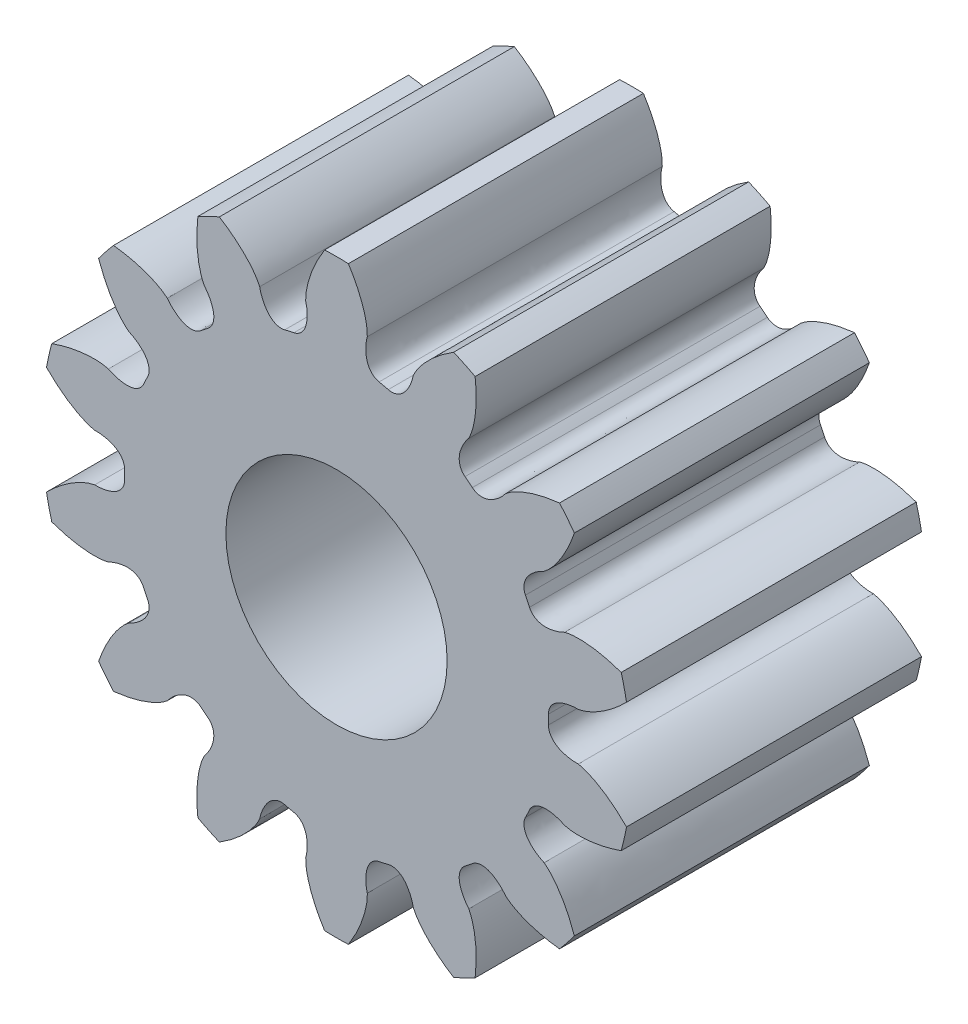
from build123d import *

# Parameters (mm, degrees)
EXTRUDE1_DEPTH = 4
SKETCH2_R      = 1.5
EXTRUDE2_DEPTH = 7.889429897


with BuildPart() as part:
    # Sketch1 → Extrude1 (new body)
    with BuildSketch(Plane.XY):
        with BuildLine():
            ThreePointArc((0.161451344, 3.996740355), (0, 4), (-0.161451344, 3.996740355))
            add(Edge.make_bspline(
                [(-0.41734284, 3.267106158), (-0.418050006, 3.293711217), (-0.417238008, 3.320180721), (-0.414906845, 3.34651467), (-0.412519014, 3.373488775), (-0.407997305, 3.400378217), (-0.402961586, 3.427010307), (-0.397809352, 3.454258609), (-0.391328249, 3.481322555), (-0.384194974, 3.508127789), (-0.376900876, 3.535537356), (-0.368546632, 3.562717007), (-0.359559396, 3.589622711), (-0.35037421, 3.61712103), (-0.340275181, 3.6443583), (-0.32957411, 3.671305216), (-0.318642529, 3.698832595), (-0.306892071, 3.726074032), (-0.294569215, 3.753008941), (-0.281986575, 3.780511674), (-0.26865316, 3.807706899), (-0.254773956, 3.834579837), (-0.240608244, 3.862007514), (-0.225743937, 3.889108115), (-0.210357616, 3.915871073), (-0.194660131, 3.943175271), (-0.178358041, 3.970131699), (-0.161451344, 3.996740355)],
                knots=[0, 0, 0, 0, 1, 1, 1, 2, 2, 2, 3, 3, 3, 4, 4, 4, 5, 5, 5, 6, 6, 6, 7, 7, 7, 8, 8, 8, 9, 9, 9, 9], degree=3))
            add(Edge.make_bspline(
                [(-0.41734284, 3.267106158), (-0.402119361, 3.209381071), (-0.395699009, 3.151699222), (-0.398081786, 3.094060611), (-0.399327936, 3.063916621), (-0.401904813, 3.033023286), (-0.409043489, 3.003664119), (-0.413736949, 2.984361367), (-0.419593991, 2.964934925), (-0.427642919, 2.946758283), (-0.433750196, 2.932966409), (-0.440827339, 2.919331468), (-0.449158532, 2.906750547), (-0.456096327, 2.896273794), (-0.46384579, 2.886114295), (-0.472383788, 2.876890981), (-0.479948802, 2.868718749), (-0.488195574, 2.86097345), (-0.496954152, 2.85409329), (-0.505054754, 2.847729993), (-0.513724525, 2.841879116), (-0.522714724, 2.836848669), (-0.531294393, 2.832047933), (-0.540339799, 2.827832828), (-0.549555771, 2.824407573), (-0.558572093, 2.821056522), (-0.567845845, 2.818396315), (-0.577377026, 2.816426951)],
                knots=[0, 0, 0, 0, 1, 1, 1, 2, 2, 2, 3, 3, 3, 4, 4, 4, 5, 5, 5, 6, 6, 6, 7, 7, 7, 8, 8, 8, 9, 9, 9, 9], degree=3))
            ThreePointArc((-0.577377026, 2.816426951), (-0.639747685, 2.802917748), (-0.701803131, 2.788027505))
            add(Edge.make_bspline(
                [(-1.04153133, 3.124639209), (-1.030201234, 3.066025482), (-1.010958555, 3.011270246), (-0.983803291, 2.9603735), (-0.969601561, 2.933755388), (-0.95387576, 2.907039519), (-0.93470557, 2.883685179), (-0.922101758, 2.868330416), (-0.908395929, 2.853369072), (-0.893257545, 2.840484782), (-0.881771009, 2.830708583), (-0.869478745, 2.821494582), (-0.856513942, 2.813774333), (-0.845717511, 2.807345301), (-0.834327445, 2.801554275), (-0.822633129, 2.796948855), (-0.812271488, 2.792868265), (-0.801480845, 2.789468131), (-0.790604448, 2.787069526), (-0.780545128, 2.784851113), (-0.770195334, 2.783341328), (-0.759912814, 2.782709753), (-0.750099839, 2.782107018), (-0.740121344, 2.782233994), (-0.730331878, 2.783146607), (-0.720754486, 2.784039449), (-0.711244904, 2.785666415), (-0.701803131, 2.788027505)],
                knots=[0, 0, 0, 0, 1, 1, 1, 2, 2, 2, 3, 3, 3, 4, 4, 4, 5, 5, 5, 6, 6, 6, 7, 7, 7, 8, 8, 8, 9, 9, 9, 9], degree=3))
            add(Edge.make_bspline(
                [(-1.04153133, 3.124639209), (-1.052437698, 3.148916366), (-1.06465397, 3.172412253), (-1.078180148, 3.195126867), (-1.092035135, 3.218393654), (-1.107775945, 3.240658309), (-1.123868202, 3.262468076), (-1.1403328, 3.284782477), (-1.157914678, 3.306354205), (-1.175971892, 3.327409874), (-1.194436212, 3.348940251), (-1.213755935, 3.369803499), (-1.233527102, 3.390145285), (-1.253733742, 3.410935112), (-1.274650461, 3.431093239), (-1.295983622, 3.450728552), (-1.317776318, 3.470786827), (-1.340182731, 3.490232182), (-1.36297186, 3.509153009), (-1.386241415, 3.528472713), (-1.410053973, 3.547189611), (-1.434218435, 3.565379332), (-1.458881724, 3.583944542), (-1.484032512, 3.601911959), (-1.50950712, 3.619348677), (-1.535496912, 3.637138026), (-1.561880544, 3.654351716), (-1.588658015, 3.670989746)],
                knots=[0, 0, 0, 0, 1, 1, 1, 2, 2, 2, 3, 3, 3, 4, 4, 4, 5, 5, 5, 6, 6, 6, 7, 7, 7, 8, 8, 8, 9, 9, 9, 9], degree=3))
            ThreePointArc((-1.588658015, 3.670989746), (-1.735534956, 3.603875472), (-1.879583284, 3.53088752))
            add(Edge.make_bspline(
                [(-1.793557142, 2.762482665), (-1.805737779, 2.786146167), (-1.816490882, 2.810346679), (-1.825816449, 2.835084201), (-1.835368712, 2.86042307), (-1.842961685, 2.886611516), (-1.84997989, 2.912791117), (-1.857160482, 2.939576459), (-1.863063817, 2.966772277), (-1.868267313, 2.994017971), (-1.873588124, 3.021877928), (-1.877854018, 3.049990718), (-1.881430745, 3.078131335), (-1.885086253, 3.106891767), (-1.88780515, 3.135813504), (-1.889855648, 3.164734857), (-1.891950315, 3.194279203), (-1.893183135, 3.223921223), (-1.893767244, 3.253535424), (-1.894363666, 3.283773933), (-1.89415024, 3.314061136), (-1.89330524, 3.344294778), (-1.892442797, 3.375152533), (-1.89080903, 3.406018712), (-1.888558447, 3.436807178), (-1.886262349, 3.468218295), (-1.883270628, 3.499578408), (-1.879583284, 3.53088752)],
                knots=[0, 0, 0, 0, 1, 1, 1, 2, 2, 2, 3, 3, 3, 4, 4, 4, 5, 5, 5, 6, 6, 6, 7, 7, 7, 8, 8, 8, 9, 9, 9, 9], degree=3))
            add(Edge.make_bspline(
                [(-1.793557142, 2.762482665), (-1.754795285, 2.717079378), (-1.723983532, 2.667895514), (-1.701121883, 2.614931073), (-1.689165639, 2.587231591), (-1.678083209, 2.558279593), (-1.671776468, 2.528730543), (-1.66762998, 2.509302947), (-1.664478174, 2.489259053), (-1.663843458, 2.469390165), (-1.663361856, 2.454314269), (-1.663822162, 2.438958954), (-1.66586965, 2.424009166), (-1.667574695, 2.411559741), (-1.670148678, 2.399043983), (-1.673839303, 2.387029566), (-1.677109346, 2.376384303), (-1.681178871, 2.365827889), (-1.686084888, 2.355828874), (-1.690622347, 2.346581023), (-1.695894941, 2.337547892), (-1.701812201, 2.329114914), (-1.707459254, 2.321067022), (-1.713780018, 2.313344689), (-1.720597159, 2.306259981), (-1.727266618, 2.299328753), (-1.734467759, 2.292908259), (-1.742200582, 2.286998498)],
                knots=[0, 0, 0, 0, 1, 1, 1, 2, 2, 2, 3, 3, 3, 4, 4, 4, 5, 5, 5, 6, 6, 6, 7, 7, 7, 8, 8, 8, 9, 9, 9, 9], degree=3))
            ThreePointArc((-1.742200582, 2.286998498), (-1.79253318, 2.247765512), (-1.84198257, 2.207425018))
            add(Edge.make_bspline(
                [(-2.294117446, 2.363299143), (-2.25847784, 2.315405944), (-2.217383378, 2.274422267), (-2.170834061, 2.24034811), (-2.146489578, 2.222527919), (-2.12072954, 2.205280923), (-2.093324727, 2.192557024), (-2.075306903, 2.18419145), (-2.056466894, 2.17665848), (-2.037237398, 2.171618435), (-2.022646652, 2.167794204), (-2.0075739, 2.164826091), (-1.992543325, 2.163495604), (-1.980026625, 2.162387642), (-1.967251898, 2.162112072), (-1.954717466, 2.163036705), (-1.943611449, 2.163855968), (-1.932414152, 2.165474439), (-1.921574142, 2.168032461), (-1.911548474, 2.170398316), (-1.90156856, 2.173528654), (-1.8920303, 2.177421042), (-1.882927598, 2.181135687), (-1.873992378, 2.185579595), (-1.865568342, 2.190649321), (-1.857326799, 2.195609219), (-1.849464876, 2.201201118), (-1.84198257, 2.207425018)],
                knots=[0, 0, 0, 0, 1, 1, 1, 2, 2, 2, 3, 3, 3, 4, 4, 4, 5, 5, 5, 6, 6, 6, 7, 7, 7, 8, 8, 8, 9, 9, 9, 9], degree=3))
            add(Edge.make_bspline(
                [(-2.294117446, 2.363299143), (-2.314477208, 2.38044001), (-2.335678172, 2.39630863), (-2.357720339, 2.410905003), (-2.380298332, 2.4258562), (-2.404140584, 2.439086278), (-2.428102109, 2.451754032), (-2.452618055, 2.464714891), (-2.477818401, 2.476521855), (-2.503223102, 2.487657626), (-2.52920056, 2.499044456), (-2.555659253, 2.50945908), (-2.582298429, 2.519208008), (-2.60952435, 2.529171662), (-2.637115947, 2.538258083), (-2.664855903, 2.546692777), (-2.693193403, 2.555309163), (-2.721817908, 2.563107043), (-2.750559643, 2.570266287), (-2.779907293, 2.577576457), (-2.809482624, 2.584107918), (-2.839146276, 2.590011723), (-2.869422274, 2.596037399), (-2.899878121, 2.601312965), (-2.930395458, 2.605969887), (-2.961529961, 2.610720988), (-2.992769532, 2.614782558), (-3.02411417, 2.618154596)],
                knots=[0, 0, 0, 0, 1, 1, 1, 2, 2, 2, 3, 3, 3, 4, 4, 4, 5, 5, 5, 6, 6, 6, 7, 7, 7, 8, 8, 8, 9, 9, 9, 9], degree=3))
            ThreePointArc((-3.02411417, 2.618154596), (-3.12732593, 2.493959207), (-3.225440703, 2.365699108))
            add(Edge.make_bspline(
                [(-2.814535456, 1.7107156), (-2.835777039, 1.726750698), (-2.855965458, 1.74388901), (-2.875100712, 1.762130535), (-2.894701128, 1.780815496), (-2.912904901, 1.801116003), (-2.930586988, 1.821657923), (-2.948678203, 1.84267514), (-2.965796746, 1.864616365), (-2.982306398, 1.886906174), (-2.999188265, 1.909698515), (-3.015229386, 1.933176361), (-3.030661662, 1.956978297), (-3.046433844, 1.981304486), (-3.061432157, 2.006182385), (-3.075828097, 2.031349947), (-3.090534138, 2.057059641), (-3.104506061, 2.083231277), (-3.117881445, 2.109659315), (-3.1315388, 2.136644492), (-3.144487635, 2.164024921), (-3.156844202, 2.191631123), (-3.169455846, 2.2198072), (-3.181376205, 2.248325531), (-3.192707115, 2.277041472), (-3.204267175, 2.30633815), (-3.215178371, 2.335890695), (-3.225440703, 2.365699108)],
                knots=[0, 0, 0, 0, 1, 1, 1, 2, 2, 2, 3, 3, 3, 4, 4, 4, 5, 5, 5, 6, 6, 6, 7, 7, 7, 8, 8, 8, 9, 9, 9, 9], degree=3))
            add(Edge.make_bspline(
                [(-2.814535456, 1.7107156), (-2.759912481, 1.686626792), (-2.710811972, 1.65568238), (-2.667233928, 1.617882365), (-2.64444337, 1.598113615), (-2.621896644, 1.576837252), (-2.603393615, 1.552950869), (-2.59122844, 1.537246305), (-2.579692042, 1.520554897), (-2.570499395, 1.502929041), (-2.5635243, 1.489555086), (-2.5572766, 1.475520707), (-2.552634854, 1.461163041), (-2.548769443, 1.449206706), (-2.545658138, 1.436813588), (-2.543770415, 1.42438767), (-2.542097816, 1.413377801), (-2.541184075, 1.4021011), (-2.541265834, 1.390963658), (-2.54134145, 1.380662902), (-2.542172565, 1.37023664), (-2.5438449, 1.360071387), (-2.54544087, 1.350370321), (-2.547785086, 1.340670264), (-2.550853179, 1.331329315), (-2.553854806, 1.322190725), (-2.557557062, 1.313281601), (-2.561959946, 1.304601945)],
                knots=[0, 0, 0, 0, 1, 1, 1, 2, 2, 2, 3, 3, 3, 4, 4, 4, 5, 5, 5, 6, 6, 6, 7, 7, 7, 8, 8, 8, 9, 9, 9, 9], degree=3))
            ThreePointArc((-2.561959946, 1.304601945), (-2.590285495, 1.24741575), (-2.617334772, 1.189614934))
            add(Edge.make_bspline(
                [(-3.092325467, 1.133878697), (-3.039435211, 1.106191862), (-2.984628229, 1.087097063), (-2.927904521, 1.076594301), (-2.898239009, 1.071101539), (-2.867546825, 1.066739395), (-2.837335249, 1.06716606), (-2.817472064, 1.067446579), (-2.797229369, 1.068833982), (-2.777717398, 1.072636423), (-2.762912319, 1.075521598), (-2.748044422, 1.079387242), (-2.733925066, 1.084710037), (-2.722167182, 1.08914259), (-2.710537985, 1.094437056), (-2.699646036, 1.100708608), (-2.689995325, 1.106265459), (-2.680609137, 1.112581976), (-2.67195251, 1.119589979), (-2.663946201, 1.126071514), (-2.656312812, 1.133221973), (-2.649407981, 1.14086739), (-2.642818454, 1.148163684), (-2.636696238, 1.156044354), (-2.631306115, 1.164267071), (-2.626032762, 1.172311656), (-2.621375647, 1.180760944), (-2.617334772, 1.189614934)],
                knots=[0, 0, 0, 0, 1, 1, 1, 2, 2, 2, 3, 3, 3, 4, 4, 4, 5, 5, 5, 6, 6, 6, 7, 7, 7, 8, 8, 8, 9, 9, 9, 9], degree=3))
            add(Edge.make_bspline(
                [(-3.092325467, 1.133878697), (-3.118106122, 1.140488316), (-3.144092667, 1.145586695), (-3.170285102, 1.149173834), (-3.197114252, 1.152848173), (-3.224335694, 1.154423297), (-3.251420615, 1.155440032), (-3.279132225, 1.156480292), (-3.306959803, 1.156183979), (-3.334680277, 1.155194276), (-3.363025718, 1.154182259), (-3.391382913, 1.152085514), (-3.419613882, 1.149310689), (-3.448466657, 1.146474747), (-3.477268277, 1.142689784), (-3.505920791, 1.138253265), (-3.535190506, 1.133721179), (-3.564363667, 1.12832712), (-3.593365354, 1.122306804), (-3.622978437, 1.116159572), (-3.652458785, 1.10921196), (-3.681746376, 1.101660528), (-3.711638551, 1.093953211), (-3.741367303, 1.085492035), (-3.770883036, 1.0764468), (-3.800995681, 1.06721864), (-3.83090381, 1.057323646), (-3.860607426, 1.046761818)],
                knots=[0, 0, 0, 0, 1, 1, 1, 2, 2, 2, 3, 3, 3, 4, 4, 4, 5, 5, 5, 6, 6, 6, 7, 7, 7, 8, 8, 8, 9, 9, 9, 9], degree=3))
            ThreePointArc((-3.860607426, 1.046761818), (-3.899711649, 0.890083736), (-3.932460034, 0.731954975))
            add(Edge.make_bspline(
                [(-3.278060504, 0.32012033), (-3.304155878, 0.325351076), (-3.32978105, 0.332032735), (-3.354936019, 0.340165306), (-3.380702484, 0.348495572), (-3.405911577, 0.358887376), (-3.430755392, 0.369723036), (-3.456174042, 0.380809411), (-3.481117257, 0.393150313), (-3.505663126, 0.406069469), (-3.530762388, 0.41927989), (-3.555401594, 0.433472718), (-3.579632867, 0.448221707), (-3.60439785, 0.463295553), (-3.628704979, 0.479202241), (-3.652595069, 0.495631266), (-3.676999772, 0.512414188), (-3.700943487, 0.529931827), (-3.724460988, 0.547939305), (-3.748474269, 0.566326406), (-3.772020689, 0.585377031), (-3.795131454, 0.604888046), (-3.818719293, 0.624801826), (-3.841832806, 0.645323905), (-3.864500983, 0.666279777), (-3.887627589, 0.687659449), (-3.910280606, 0.709551181), (-3.932460034, 0.731954975)],
                knots=[0, 0, 0, 0, 1, 1, 1, 2, 2, 2, 3, 3, 3, 4, 4, 4, 5, 5, 5, 6, 6, 6, 7, 7, 7, 8, 8, 8, 9, 9, 9, 9], degree=3))
            add(Edge.make_bspline(
                [(-3.278060504, 0.32012033), (-3.218395163, 0.322117084), (-3.160730856, 0.315541045), (-3.105067583, 0.300392213), (-3.07595666, 0.292469637), (-3.046411294, 0.283082954), (-3.019376728, 0.26959023), (-3.001602329, 0.260719178), (-2.983966263, 0.250686195), (-2.968036402, 0.238794387), (-2.955949317, 0.229771251), (-2.944231044, 0.219837488), (-2.933819418, 0.208915656), (-2.925149144, 0.199820509), (-2.916968782, 0.19000464), (-2.9098766, 0.179628328), (-2.903592636, 0.170434492), (-2.897876608, 0.160670993), (-2.893117914, 0.15060103), (-2.888716712, 0.141287561), (-2.884941735, 0.131533217), (-2.882037918, 0.12164904), (-2.879266703, 0.112216218), (-2.877170071, 0.10245965), (-2.875881442, 0.092712551), (-2.874620729, 0.083176608), (-2.874090822, 0.073543416), (-2.874291722, 0.063812977)],
                knots=[0, 0, 0, 0, 1, 1, 1, 2, 2, 2, 3, 3, 3, 4, 4, 4, 5, 5, 5, 6, 6, 6, 7, 7, 7, 8, 8, 8, 9, 9, 9, 9], degree=3))
            ThreePointArc((-2.874291722, 0.063812977), (-2.875, 0), (-2.874291722, -0.063812977))
            add(Edge.make_bspline(
                [(-3.278060504, -0.32012033), (-3.218395163, -0.322117084), (-3.160730856, -0.315541045), (-3.105067583, -0.300392213), (-3.07595666, -0.292469637), (-3.046411294, -0.283082954), (-3.019376728, -0.26959023), (-3.001602329, -0.260719178), (-2.983966263, -0.250686195), (-2.968036402, -0.238794387), (-2.955949317, -0.229771251), (-2.944231044, -0.219837488), (-2.933819418, -0.208915656), (-2.925149144, -0.199820509), (-2.916968782, -0.19000464), (-2.9098766, -0.179628328), (-2.903592636, -0.170434492), (-2.897876608, -0.160670993), (-2.893117914, -0.15060103), (-2.888716712, -0.141287561), (-2.884941735, -0.131533217), (-2.882037918, -0.12164904), (-2.879266703, -0.112216218), (-2.877170071, -0.10245965), (-2.875881442, -0.092712551), (-2.874620729, -0.083176608), (-2.874090822, -0.073543416), (-2.874291722, -0.063812977)],
                knots=[0, 0, 0, 0, 1, 1, 1, 2, 2, 2, 3, 3, 3, 4, 4, 4, 5, 5, 5, 6, 6, 6, 7, 7, 7, 8, 8, 8, 9, 9, 9, 9], degree=3))
            add(Edge.make_bspline(
                [(-3.278060504, -0.32012033), (-3.304155878, -0.325351076), (-3.32978105, -0.332032735), (-3.354936019, -0.340165306), (-3.380702484, -0.348495572), (-3.405911577, -0.358887376), (-3.430755392, -0.369723036), (-3.456174042, -0.380809411), (-3.481117257, -0.393150313), (-3.505663126, -0.406069469), (-3.530762388, -0.41927989), (-3.555401594, -0.433472718), (-3.579632867, -0.448221707), (-3.60439785, -0.463295553), (-3.628704979, -0.479202241), (-3.652595069, -0.495631266), (-3.676999772, -0.512414188), (-3.700943487, -0.529931827), (-3.724460988, -0.547939305), (-3.748474269, -0.566326406), (-3.772020689, -0.585377031), (-3.795131454, -0.604888046), (-3.818719293, -0.624801826), (-3.841832806, -0.645323905), (-3.864500983, -0.666279777), (-3.887627589, -0.687659449), (-3.910280606, -0.709551181), (-3.932460034, -0.731954975)],
                knots=[0, 0, 0, 0, 1, 1, 1, 2, 2, 2, 3, 3, 3, 4, 4, 4, 5, 5, 5, 6, 6, 6, 7, 7, 7, 8, 8, 8, 9, 9, 9, 9], degree=3))
            ThreePointArc((-3.932460034, -0.731954975), (-3.899711649, -0.890083736), (-3.860607426, -1.046761818))
            add(Edge.make_bspline(
                [(-3.092325467, -1.133878697), (-3.118106122, -1.140488316), (-3.144092667, -1.145586695), (-3.170285102, -1.149173834), (-3.197114252, -1.152848173), (-3.224335694, -1.154423297), (-3.251420615, -1.155440032), (-3.279132225, -1.156480292), (-3.306959803, -1.156183979), (-3.334680277, -1.155194276), (-3.363025718, -1.154182259), (-3.391382913, -1.152085514), (-3.419613882, -1.149310689), (-3.448466657, -1.146474747), (-3.477268277, -1.142689784), (-3.505920791, -1.138253265), (-3.535190506, -1.133721179), (-3.564363667, -1.12832712), (-3.593365354, -1.122306804), (-3.622978437, -1.116159572), (-3.652458785, -1.10921196), (-3.681746376, -1.101660528), (-3.711638551, -1.093953211), (-3.741367303, -1.085492035), (-3.770883036, -1.0764468), (-3.800995681, -1.06721864), (-3.83090381, -1.057323646), (-3.860607426, -1.046761818)],
                knots=[0, 0, 0, 0, 1, 1, 1, 2, 2, 2, 3, 3, 3, 4, 4, 4, 5, 5, 5, 6, 6, 6, 7, 7, 7, 8, 8, 8, 9, 9, 9, 9], degree=3))
            add(Edge.make_bspline(
                [(-3.092325467, -1.133878697), (-3.039435211, -1.106191862), (-2.984628229, -1.087097063), (-2.927904521, -1.076594301), (-2.898239009, -1.071101539), (-2.867546825, -1.066739395), (-2.837335249, -1.06716606), (-2.817472064, -1.067446579), (-2.797229369, -1.068833982), (-2.777717398, -1.072636423), (-2.762912319, -1.075521598), (-2.748044422, -1.079387242), (-2.733925066, -1.084710037), (-2.722167182, -1.08914259), (-2.710537985, -1.094437056), (-2.699646036, -1.100708608), (-2.689995325, -1.106265459), (-2.680609137, -1.112581976), (-2.67195251, -1.119589979), (-2.663946201, -1.126071514), (-2.656312812, -1.133221973), (-2.649407981, -1.14086739), (-2.642818454, -1.148163684), (-2.636696238, -1.156044354), (-2.631306115, -1.164267071), (-2.626032762, -1.172311656), (-2.621375647, -1.180760944), (-2.617334772, -1.189614934)],
                knots=[0, 0, 0, 0, 1, 1, 1, 2, 2, 2, 3, 3, 3, 4, 4, 4, 5, 5, 5, 6, 6, 6, 7, 7, 7, 8, 8, 8, 9, 9, 9, 9], degree=3))
            ThreePointArc((-2.617334772, -1.189614934), (-2.590285495, -1.24741575), (-2.561959946, -1.304601945))
            add(Edge.make_bspline(
                [(-2.814535456, -1.7107156), (-2.759912481, -1.686626792), (-2.710811972, -1.65568238), (-2.667233928, -1.617882365), (-2.64444337, -1.598113615), (-2.621896644, -1.576837252), (-2.603393615, -1.552950869), (-2.59122844, -1.537246305), (-2.579692042, -1.520554897), (-2.570499395, -1.502929041), (-2.5635243, -1.489555086), (-2.5572766, -1.475520707), (-2.552634854, -1.461163041), (-2.548769443, -1.449206706), (-2.545658138, -1.436813588), (-2.543770415, -1.42438767), (-2.542097816, -1.413377801), (-2.541184075, -1.4021011), (-2.541265834, -1.390963658), (-2.54134145, -1.380662902), (-2.542172565, -1.37023664), (-2.5438449, -1.360071387), (-2.54544087, -1.350370321), (-2.547785086, -1.340670264), (-2.550853179, -1.331329315), (-2.553854806, -1.322190725), (-2.557557062, -1.313281601), (-2.561959946, -1.304601945)],
                knots=[0, 0, 0, 0, 1, 1, 1, 2, 2, 2, 3, 3, 3, 4, 4, 4, 5, 5, 5, 6, 6, 6, 7, 7, 7, 8, 8, 8, 9, 9, 9, 9], degree=3))
            add(Edge.make_bspline(
                [(-2.814535456, -1.7107156), (-2.835777039, -1.726750698), (-2.855965458, -1.74388901), (-2.875100712, -1.762130535), (-2.894701128, -1.780815496), (-2.912904901, -1.801116003), (-2.930586988, -1.821657923), (-2.948678203, -1.84267514), (-2.965796746, -1.864616365), (-2.982306398, -1.886906174), (-2.999188265, -1.909698515), (-3.015229386, -1.933176361), (-3.030661662, -1.956978297), (-3.046433844, -1.981304486), (-3.061432157, -2.006182385), (-3.075828097, -2.031349947), (-3.090534138, -2.057059641), (-3.104506061, -2.083231277), (-3.117881445, -2.109659315), (-3.1315388, -2.136644492), (-3.144487635, -2.164024921), (-3.156844202, -2.191631123), (-3.169455846, -2.2198072), (-3.181376205, -2.248325531), (-3.192707115, -2.277041472), (-3.204267175, -2.30633815), (-3.215178371, -2.335890695), (-3.225440703, -2.365699108)],
                knots=[0, 0, 0, 0, 1, 1, 1, 2, 2, 2, 3, 3, 3, 4, 4, 4, 5, 5, 5, 6, 6, 6, 7, 7, 7, 8, 8, 8, 9, 9, 9, 9], degree=3))
            ThreePointArc((-3.225440703, -2.365699108), (-3.12732593, -2.493959207), (-3.02411417, -2.618154596))
            add(Edge.make_bspline(
                [(-2.294117446, -2.363299143), (-2.314477208, -2.38044001), (-2.335678172, -2.39630863), (-2.357720339, -2.410905003), (-2.380298332, -2.4258562), (-2.404140584, -2.439086278), (-2.428102109, -2.451754032), (-2.452618055, -2.464714891), (-2.477818401, -2.476521855), (-2.503223102, -2.487657626), (-2.52920056, -2.499044456), (-2.555659253, -2.50945908), (-2.582298429, -2.519208008), (-2.60952435, -2.529171662), (-2.637115947, -2.538258083), (-2.664855903, -2.546692777), (-2.693193403, -2.555309163), (-2.721817908, -2.563107043), (-2.750559643, -2.570266287), (-2.779907293, -2.577576457), (-2.809482624, -2.584107918), (-2.839146276, -2.590011723), (-2.869422274, -2.596037399), (-2.899878121, -2.601312965), (-2.930395458, -2.605969887), (-2.961529961, -2.610720988), (-2.992769532, -2.614782558), (-3.02411417, -2.618154596)],
                knots=[0, 0, 0, 0, 1, 1, 1, 2, 2, 2, 3, 3, 3, 4, 4, 4, 5, 5, 5, 6, 6, 6, 7, 7, 7, 8, 8, 8, 9, 9, 9, 9], degree=3))
            add(Edge.make_bspline(
                [(-2.294117446, -2.363299143), (-2.25847784, -2.315405944), (-2.217383378, -2.274422267), (-2.170834061, -2.24034811), (-2.146489578, -2.222527919), (-2.12072954, -2.205280923), (-2.093324727, -2.192557024), (-2.075306903, -2.18419145), (-2.056466894, -2.17665848), (-2.037237398, -2.171618435), (-2.022646652, -2.167794204), (-2.0075739, -2.164826091), (-1.992543325, -2.163495604), (-1.980026625, -2.162387642), (-1.967251898, -2.162112072), (-1.954717466, -2.163036705), (-1.943611449, -2.163855968), (-1.932414152, -2.165474439), (-1.921574142, -2.168032461), (-1.911548474, -2.170398316), (-1.90156856, -2.173528654), (-1.8920303, -2.177421042), (-1.882927598, -2.181135687), (-1.873992378, -2.185579595), (-1.865568342, -2.190649321), (-1.857326799, -2.195609219), (-1.849464876, -2.201201118), (-1.84198257, -2.207425018)],
                knots=[0, 0, 0, 0, 1, 1, 1, 2, 2, 2, 3, 3, 3, 4, 4, 4, 5, 5, 5, 6, 6, 6, 7, 7, 7, 8, 8, 8, 9, 9, 9, 9], degree=3))
            ThreePointArc((-1.84198257, -2.207425018), (-1.79253318, -2.247765512), (-1.742200582, -2.286998498))
            add(Edge.make_bspline(
                [(-1.793557142, -2.762482665), (-1.754795285, -2.717079378), (-1.723983532, -2.667895514), (-1.701121883, -2.614931073), (-1.689165639, -2.587231591), (-1.678083209, -2.558279593), (-1.671776468, -2.528730543), (-1.66762998, -2.509302947), (-1.664478174, -2.489259053), (-1.663843458, -2.469390165), (-1.663361856, -2.454314269), (-1.663822162, -2.438958954), (-1.66586965, -2.424009166), (-1.667574695, -2.411559741), (-1.670148678, -2.399043983), (-1.673839303, -2.387029566), (-1.677109346, -2.376384303), (-1.681178871, -2.365827889), (-1.686084888, -2.355828874), (-1.690622347, -2.346581023), (-1.695894941, -2.337547892), (-1.701812201, -2.329114914), (-1.707459254, -2.321067022), (-1.713780018, -2.313344689), (-1.720597159, -2.306259981), (-1.727266618, -2.299328753), (-1.734467759, -2.292908259), (-1.742200582, -2.286998498)],
                knots=[0, 0, 0, 0, 1, 1, 1, 2, 2, 2, 3, 3, 3, 4, 4, 4, 5, 5, 5, 6, 6, 6, 7, 7, 7, 8, 8, 8, 9, 9, 9, 9], degree=3))
            add(Edge.make_bspline(
                [(-1.793557142, -2.762482665), (-1.805737779, -2.786146167), (-1.816490882, -2.810346679), (-1.825816449, -2.835084201), (-1.835368712, -2.86042307), (-1.842961685, -2.886611516), (-1.84997989, -2.912791117), (-1.857160482, -2.939576459), (-1.863063817, -2.966772277), (-1.868267313, -2.994017971), (-1.873588124, -3.021877928), (-1.877854018, -3.049990718), (-1.881430745, -3.078131335), (-1.885086253, -3.106891767), (-1.88780515, -3.135813504), (-1.889855648, -3.164734857), (-1.891950315, -3.194279203), (-1.893183135, -3.223921223), (-1.893767244, -3.253535424), (-1.894363666, -3.283773933), (-1.89415024, -3.314061136), (-1.89330524, -3.344294778), (-1.892442797, -3.375152533), (-1.89080903, -3.406018712), (-1.888558447, -3.436807178), (-1.886262349, -3.468218295), (-1.883270628, -3.499578408), (-1.879583284, -3.53088752)],
                knots=[0, 0, 0, 0, 1, 1, 1, 2, 2, 2, 3, 3, 3, 4, 4, 4, 5, 5, 5, 6, 6, 6, 7, 7, 7, 8, 8, 8, 9, 9, 9, 9], degree=3))
            ThreePointArc((-1.879583284, -3.53088752), (-1.735534956, -3.603875472), (-1.588658015, -3.670989746))
            add(Edge.make_bspline(
                [(-1.04153133, -3.124639209), (-1.052437698, -3.148916366), (-1.06465397, -3.172412253), (-1.078180148, -3.195126867), (-1.092035135, -3.218393654), (-1.107775945, -3.240658309), (-1.123868202, -3.262468076), (-1.1403328, -3.284782477), (-1.157914678, -3.306354205), (-1.175971892, -3.327409874), (-1.194436212, -3.348940251), (-1.213755935, -3.369803499), (-1.233527102, -3.390145285), (-1.253733742, -3.410935112), (-1.274650461, -3.431093239), (-1.295983622, -3.450728552), (-1.317776318, -3.470786827), (-1.340182731, -3.490232182), (-1.36297186, -3.509153009), (-1.386241415, -3.528472713), (-1.410053973, -3.547189611), (-1.434218435, -3.565379332), (-1.458881724, -3.583944542), (-1.484032512, -3.601911959), (-1.50950712, -3.619348677), (-1.535496912, -3.637138026), (-1.561880544, -3.654351716), (-1.588658015, -3.670989746)],
                knots=[0, 0, 0, 0, 1, 1, 1, 2, 2, 2, 3, 3, 3, 4, 4, 4, 5, 5, 5, 6, 6, 6, 7, 7, 7, 8, 8, 8, 9, 9, 9, 9], degree=3))
            add(Edge.make_bspline(
                [(-1.04153133, -3.124639209), (-1.030201234, -3.066025482), (-1.010958555, -3.011270246), (-0.983803291, -2.9603735), (-0.969601561, -2.933755388), (-0.95387576, -2.907039519), (-0.93470557, -2.883685179), (-0.922101758, -2.868330416), (-0.908395929, -2.853369072), (-0.893257545, -2.840484782), (-0.881771009, -2.830708583), (-0.869478745, -2.821494582), (-0.856513942, -2.813774333), (-0.845717511, -2.807345301), (-0.834327445, -2.801554275), (-0.822633129, -2.796948855), (-0.812271488, -2.792868265), (-0.801480845, -2.789468131), (-0.790604448, -2.787069526), (-0.780545128, -2.784851113), (-0.770195334, -2.783341328), (-0.759912814, -2.782709753), (-0.750099839, -2.782107018), (-0.740121344, -2.782233994), (-0.730331878, -2.783146607), (-0.720754486, -2.784039449), (-0.711244904, -2.785666415), (-0.701803131, -2.788027505)],
                knots=[0, 0, 0, 0, 1, 1, 1, 2, 2, 2, 3, 3, 3, 4, 4, 4, 5, 5, 5, 6, 6, 6, 7, 7, 7, 8, 8, 8, 9, 9, 9, 9], degree=3))
            ThreePointArc((-0.701803131, -2.788027505), (-0.639747685, -2.802917748), (-0.577377026, -2.816426951))
            add(Edge.make_bspline(
                [(-0.41734284, -3.267106158), (-0.402119361, -3.209381071), (-0.395699009, -3.151699222), (-0.398081786, -3.094060611), (-0.399327936, -3.063916621), (-0.401904813, -3.033023286), (-0.409043489, -3.003664119), (-0.413736949, -2.984361367), (-0.419593991, -2.964934925), (-0.427642919, -2.946758283), (-0.433750196, -2.932966409), (-0.440827339, -2.919331468), (-0.449158532, -2.906750547), (-0.456096327, -2.896273794), (-0.46384579, -2.886114295), (-0.472383788, -2.876890981), (-0.479948802, -2.868718749), (-0.488195574, -2.86097345), (-0.496954152, -2.85409329), (-0.505054754, -2.847729993), (-0.513724525, -2.841879116), (-0.522714724, -2.836848669), (-0.531294393, -2.832047933), (-0.540339799, -2.827832828), (-0.549555771, -2.824407573), (-0.558572093, -2.821056522), (-0.567845845, -2.818396315), (-0.577377026, -2.816426951)],
                knots=[0, 0, 0, 0, 1, 1, 1, 2, 2, 2, 3, 3, 3, 4, 4, 4, 5, 5, 5, 6, 6, 6, 7, 7, 7, 8, 8, 8, 9, 9, 9, 9], degree=3))
            add(Edge.make_bspline(
                [(-0.41734284, -3.267106158), (-0.418050006, -3.293711217), (-0.417238008, -3.320180721), (-0.414906845, -3.34651467), (-0.412519014, -3.373488775), (-0.407997305, -3.400378217), (-0.402961586, -3.427010307), (-0.397809352, -3.454258609), (-0.391328249, -3.481322555), (-0.384194974, -3.508127789), (-0.376900876, -3.535537356), (-0.368546632, -3.562717007), (-0.359559396, -3.589622711), (-0.35037421, -3.61712103), (-0.340275181, -3.6443583), (-0.32957411, -3.671305216), (-0.318642529, -3.698832595), (-0.306892071, -3.726074032), (-0.294569215, -3.753008941), (-0.281986575, -3.780511674), (-0.26865316, -3.807706899), (-0.254773956, -3.834579837), (-0.240608244, -3.862007514), (-0.225743937, -3.889108115), (-0.210357616, -3.915871073), (-0.194660131, -3.943175271), (-0.178358041, -3.970131699), (-0.161451344, -3.996740355)],
                knots=[0, 0, 0, 0, 1, 1, 1, 2, 2, 2, 3, 3, 3, 4, 4, 4, 5, 5, 5, 6, 6, 6, 7, 7, 7, 8, 8, 8, 9, 9, 9, 9], degree=3))
            ThreePointArc((-0.161451344, -3.996740355), (0, -4), (0.161451344, -3.996740355))
            add(Edge.make_bspline(
                [(0.41734284, -3.267106158), (0.418050006, -3.293711217), (0.417238008, -3.320180721), (0.414906845, -3.34651467), (0.412519014, -3.373488775), (0.407997305, -3.400378217), (0.402961586, -3.427010307), (0.397809352, -3.454258609), (0.391328249, -3.481322555), (0.384194974, -3.508127789), (0.376900876, -3.535537356), (0.368546632, -3.562717007), (0.359559396, -3.589622711), (0.35037421, -3.61712103), (0.340275181, -3.6443583), (0.32957411, -3.671305216), (0.318642529, -3.698832595), (0.306892071, -3.726074032), (0.294569215, -3.753008941), (0.281986575, -3.780511674), (0.26865316, -3.807706899), (0.254773956, -3.834579837), (0.240608244, -3.862007514), (0.225743937, -3.889108115), (0.210357616, -3.915871073), (0.194660131, -3.943175271), (0.178358041, -3.970131699), (0.161451344, -3.996740355)],
                knots=[0, 0, 0, 0, 1, 1, 1, 2, 2, 2, 3, 3, 3, 4, 4, 4, 5, 5, 5, 6, 6, 6, 7, 7, 7, 8, 8, 8, 9, 9, 9, 9], degree=3))
            add(Edge.make_bspline(
                [(0.41734284, -3.267106158), (0.402119361, -3.209381071), (0.395699009, -3.151699222), (0.398081786, -3.094060611), (0.399327936, -3.063916621), (0.401904813, -3.033023286), (0.409043489, -3.003664119), (0.413736949, -2.984361367), (0.419593991, -2.964934925), (0.427642919, -2.946758283), (0.433750196, -2.932966409), (0.440827339, -2.919331468), (0.449158532, -2.906750547), (0.456096327, -2.896273794), (0.46384579, -2.886114295), (0.472383788, -2.876890981), (0.479948802, -2.868718749), (0.488195574, -2.86097345), (0.496954152, -2.85409329), (0.505054754, -2.847729993), (0.513724525, -2.841879116), (0.522714724, -2.836848669), (0.531294393, -2.832047933), (0.540339799, -2.827832828), (0.549555771, -2.824407573), (0.558572093, -2.821056522), (0.567845845, -2.818396315), (0.577377026, -2.816426951)],
                knots=[0, 0, 0, 0, 1, 1, 1, 2, 2, 2, 3, 3, 3, 4, 4, 4, 5, 5, 5, 6, 6, 6, 7, 7, 7, 8, 8, 8, 9, 9, 9, 9], degree=3))
            ThreePointArc((0.577377026, -2.816426951), (0.639747685, -2.802917748), (0.701803131, -2.788027505))
            add(Edge.make_bspline(
                [(1.04153133, -3.124639209), (1.030201234, -3.066025482), (1.010958555, -3.011270246), (0.983803291, -2.9603735), (0.969601561, -2.933755388), (0.95387576, -2.907039519), (0.93470557, -2.883685179), (0.922101758, -2.868330416), (0.908395929, -2.853369072), (0.893257545, -2.840484782), (0.881771009, -2.830708583), (0.869478745, -2.821494582), (0.856513942, -2.813774333), (0.845717511, -2.807345301), (0.834327445, -2.801554275), (0.822633129, -2.796948855), (0.812271488, -2.792868265), (0.801480845, -2.789468131), (0.790604448, -2.787069526), (0.780545128, -2.784851113), (0.770195334, -2.783341328), (0.759912814, -2.782709753), (0.750099839, -2.782107018), (0.740121344, -2.782233994), (0.730331878, -2.783146607), (0.720754486, -2.784039449), (0.711244904, -2.785666415), (0.701803131, -2.788027505)],
                knots=[0, 0, 0, 0, 1, 1, 1, 2, 2, 2, 3, 3, 3, 4, 4, 4, 5, 5, 5, 6, 6, 6, 7, 7, 7, 8, 8, 8, 9, 9, 9, 9], degree=3))
            add(Edge.make_bspline(
                [(1.04153133, -3.124639209), (1.052437698, -3.148916366), (1.06465397, -3.172412253), (1.078180148, -3.195126867), (1.092035135, -3.218393654), (1.107775945, -3.240658309), (1.123868202, -3.262468076), (1.1403328, -3.284782477), (1.157914678, -3.306354205), (1.175971892, -3.327409874), (1.194436212, -3.348940251), (1.213755935, -3.369803499), (1.233527102, -3.390145285), (1.253733742, -3.410935112), (1.274650461, -3.431093239), (1.295983622, -3.450728552), (1.317776318, -3.470786827), (1.340182731, -3.490232182), (1.36297186, -3.509153009), (1.386241415, -3.528472713), (1.410053973, -3.547189611), (1.434218435, -3.565379332), (1.458881724, -3.583944542), (1.484032512, -3.601911959), (1.50950712, -3.619348677), (1.535496912, -3.637138026), (1.561880544, -3.654351716), (1.588658015, -3.670989746)],
                knots=[0, 0, 0, 0, 1, 1, 1, 2, 2, 2, 3, 3, 3, 4, 4, 4, 5, 5, 5, 6, 6, 6, 7, 7, 7, 8, 8, 8, 9, 9, 9, 9], degree=3))
            ThreePointArc((1.588658015, -3.670989746), (1.735534956, -3.603875472), (1.879583284, -3.53088752))
            add(Edge.make_bspline(
                [(1.793557142, -2.762482665), (1.805737779, -2.786146167), (1.816490882, -2.810346679), (1.825816449, -2.835084201), (1.835368712, -2.86042307), (1.842961685, -2.886611516), (1.84997989, -2.912791117), (1.857160482, -2.939576459), (1.863063817, -2.966772277), (1.868267313, -2.994017971), (1.873588124, -3.021877928), (1.877854018, -3.049990718), (1.881430745, -3.078131335), (1.885086253, -3.106891767), (1.88780515, -3.135813504), (1.889855648, -3.164734857), (1.891950315, -3.194279203), (1.893183135, -3.223921223), (1.893767244, -3.253535424), (1.894363666, -3.283773933), (1.89415024, -3.314061136), (1.89330524, -3.344294778), (1.892442797, -3.375152533), (1.89080903, -3.406018712), (1.888558447, -3.436807178), (1.886262349, -3.468218295), (1.883270628, -3.499578408), (1.879583284, -3.53088752)],
                knots=[0, 0, 0, 0, 1, 1, 1, 2, 2, 2, 3, 3, 3, 4, 4, 4, 5, 5, 5, 6, 6, 6, 7, 7, 7, 8, 8, 8, 9, 9, 9, 9], degree=3))
            add(Edge.make_bspline(
                [(1.793557142, -2.762482665), (1.754795285, -2.717079378), (1.723983532, -2.667895514), (1.701121883, -2.614931073), (1.689165639, -2.587231591), (1.678083209, -2.558279593), (1.671776468, -2.528730543), (1.66762998, -2.509302947), (1.664478174, -2.489259053), (1.663843458, -2.469390165), (1.663361856, -2.454314269), (1.663822162, -2.438958954), (1.66586965, -2.424009166), (1.667574695, -2.411559741), (1.670148678, -2.399043983), (1.673839303, -2.387029566), (1.677109346, -2.376384303), (1.681178871, -2.365827889), (1.686084888, -2.355828874), (1.690622347, -2.346581023), (1.695894941, -2.337547892), (1.701812201, -2.329114914), (1.707459254, -2.321067022), (1.713780018, -2.313344689), (1.720597159, -2.306259981), (1.727266618, -2.299328753), (1.734467759, -2.292908259), (1.742200582, -2.286998498)],
                knots=[0, 0, 0, 0, 1, 1, 1, 2, 2, 2, 3, 3, 3, 4, 4, 4, 5, 5, 5, 6, 6, 6, 7, 7, 7, 8, 8, 8, 9, 9, 9, 9], degree=3))
            ThreePointArc((1.742200582, -2.286998498), (1.79253318, -2.247765512), (1.84198257, -2.207425018))
            add(Edge.make_bspline(
                [(2.294117446, -2.363299143), (2.25847784, -2.315405944), (2.217383378, -2.274422267), (2.170834061, -2.24034811), (2.146489578, -2.222527919), (2.12072954, -2.205280923), (2.093324727, -2.192557024), (2.075306903, -2.18419145), (2.056466894, -2.17665848), (2.037237398, -2.171618435), (2.022646652, -2.167794204), (2.0075739, -2.164826091), (1.992543325, -2.163495604), (1.980026625, -2.162387642), (1.967251898, -2.162112072), (1.954717466, -2.163036705), (1.943611449, -2.163855968), (1.932414152, -2.165474439), (1.921574142, -2.168032461), (1.911548474, -2.170398316), (1.90156856, -2.173528654), (1.8920303, -2.177421042), (1.882927598, -2.181135687), (1.873992378, -2.185579595), (1.865568342, -2.190649321), (1.857326799, -2.195609219), (1.849464876, -2.201201118), (1.84198257, -2.207425018)],
                knots=[0, 0, 0, 0, 1, 1, 1, 2, 2, 2, 3, 3, 3, 4, 4, 4, 5, 5, 5, 6, 6, 6, 7, 7, 7, 8, 8, 8, 9, 9, 9, 9], degree=3))
            add(Edge.make_bspline(
                [(2.294117446, -2.363299143), (2.314477208, -2.38044001), (2.335678172, -2.39630863), (2.357720339, -2.410905003), (2.380298332, -2.4258562), (2.404140584, -2.439086278), (2.428102109, -2.451754032), (2.452618055, -2.464714891), (2.477818401, -2.476521855), (2.503223102, -2.487657626), (2.52920056, -2.499044456), (2.555659253, -2.50945908), (2.582298429, -2.519208008), (2.60952435, -2.529171662), (2.637115947, -2.538258083), (2.664855903, -2.546692777), (2.693193403, -2.555309163), (2.721817908, -2.563107043), (2.750559643, -2.570266287), (2.779907293, -2.577576457), (2.809482624, -2.584107918), (2.839146276, -2.590011723), (2.869422274, -2.596037399), (2.899878121, -2.601312965), (2.930395458, -2.605969887), (2.961529961, -2.610720988), (2.992769532, -2.614782558), (3.02411417, -2.618154596)],
                knots=[0, 0, 0, 0, 1, 1, 1, 2, 2, 2, 3, 3, 3, 4, 4, 4, 5, 5, 5, 6, 6, 6, 7, 7, 7, 8, 8, 8, 9, 9, 9, 9], degree=3))
            ThreePointArc((3.02411417, -2.618154596), (3.12732593, -2.493959207), (3.225440703, -2.365699108))
            add(Edge.make_bspline(
                [(2.814535456, -1.7107156), (2.835777039, -1.726750698), (2.855965458, -1.74388901), (2.875100712, -1.762130535), (2.894701128, -1.780815496), (2.912904901, -1.801116003), (2.930586988, -1.821657923), (2.948678203, -1.84267514), (2.965796746, -1.864616365), (2.982306398, -1.886906174), (2.999188265, -1.909698515), (3.015229386, -1.933176361), (3.030661662, -1.956978297), (3.046433844, -1.981304486), (3.061432157, -2.006182385), (3.075828097, -2.031349947), (3.090534138, -2.057059641), (3.104506061, -2.083231277), (3.117881445, -2.109659315), (3.1315388, -2.136644492), (3.144487635, -2.164024921), (3.156844202, -2.191631123), (3.169455846, -2.2198072), (3.181376205, -2.248325531), (3.192707115, -2.277041472), (3.204267175, -2.30633815), (3.215178371, -2.335890695), (3.225440703, -2.365699108)],
                knots=[0, 0, 0, 0, 1, 1, 1, 2, 2, 2, 3, 3, 3, 4, 4, 4, 5, 5, 5, 6, 6, 6, 7, 7, 7, 8, 8, 8, 9, 9, 9, 9], degree=3))
            add(Edge.make_bspline(
                [(2.814535456, -1.7107156), (2.759912481, -1.686626792), (2.710811972, -1.65568238), (2.667233928, -1.617882365), (2.64444337, -1.598113615), (2.621896644, -1.576837252), (2.603393615, -1.552950869), (2.59122844, -1.537246305), (2.579692042, -1.520554897), (2.570499395, -1.502929041), (2.5635243, -1.489555086), (2.5572766, -1.475520707), (2.552634854, -1.461163041), (2.548769443, -1.449206706), (2.545658138, -1.436813588), (2.543770415, -1.42438767), (2.542097816, -1.413377801), (2.541184075, -1.4021011), (2.541265834, -1.390963658), (2.54134145, -1.380662902), (2.542172565, -1.37023664), (2.5438449, -1.360071387), (2.54544087, -1.350370321), (2.547785086, -1.340670264), (2.550853179, -1.331329315), (2.553854806, -1.322190725), (2.557557062, -1.313281601), (2.561959946, -1.304601945)],
                knots=[0, 0, 0, 0, 1, 1, 1, 2, 2, 2, 3, 3, 3, 4, 4, 4, 5, 5, 5, 6, 6, 6, 7, 7, 7, 8, 8, 8, 9, 9, 9, 9], degree=3))
            ThreePointArc((2.561959946, -1.304601945), (2.590285495, -1.24741575), (2.617334772, -1.189614934))
            add(Edge.make_bspline(
                [(3.092325467, -1.133878697), (3.039435211, -1.106191862), (2.984628229, -1.087097063), (2.927904521, -1.076594301), (2.898239009, -1.071101539), (2.867546825, -1.066739395), (2.837335249, -1.06716606), (2.817472064, -1.067446579), (2.797229369, -1.068833982), (2.777717398, -1.072636423), (2.762912319, -1.075521598), (2.748044422, -1.079387242), (2.733925066, -1.084710037), (2.722167182, -1.08914259), (2.710537985, -1.094437056), (2.699646036, -1.100708608), (2.689995325, -1.106265459), (2.680609137, -1.112581976), (2.67195251, -1.119589979), (2.663946201, -1.126071514), (2.656312812, -1.133221973), (2.649407981, -1.14086739), (2.642818454, -1.148163684), (2.636696238, -1.156044354), (2.631306115, -1.164267071), (2.626032762, -1.172311656), (2.621375647, -1.180760944), (2.617334772, -1.189614934)],
                knots=[0, 0, 0, 0, 1, 1, 1, 2, 2, 2, 3, 3, 3, 4, 4, 4, 5, 5, 5, 6, 6, 6, 7, 7, 7, 8, 8, 8, 9, 9, 9, 9], degree=3))
            add(Edge.make_bspline(
                [(3.092325467, -1.133878697), (3.118106122, -1.140488316), (3.144092667, -1.145586695), (3.170285102, -1.149173834), (3.197114252, -1.152848173), (3.224335694, -1.154423297), (3.251420615, -1.155440032), (3.279132225, -1.156480292), (3.306959803, -1.156183979), (3.334680277, -1.155194276), (3.363025718, -1.154182259), (3.391382913, -1.152085514), (3.419613882, -1.149310689), (3.448466657, -1.146474747), (3.477268277, -1.142689784), (3.505920791, -1.138253265), (3.535190506, -1.133721179), (3.564363667, -1.12832712), (3.593365354, -1.122306804), (3.622978437, -1.116159572), (3.652458785, -1.10921196), (3.681746376, -1.101660528), (3.711638551, -1.093953211), (3.741367303, -1.085492035), (3.770883036, -1.0764468), (3.800995681, -1.06721864), (3.83090381, -1.057323646), (3.860607426, -1.046761818)],
                knots=[0, 0, 0, 0, 1, 1, 1, 2, 2, 2, 3, 3, 3, 4, 4, 4, 5, 5, 5, 6, 6, 6, 7, 7, 7, 8, 8, 8, 9, 9, 9, 9], degree=3))
            ThreePointArc((3.860607426, -1.046761818), (3.899711649, -0.890083736), (3.932460034, -0.731954975))
            add(Edge.make_bspline(
                [(3.278060504, -0.32012033), (3.304155878, -0.325351076), (3.32978105, -0.332032735), (3.354936019, -0.340165306), (3.380702484, -0.348495572), (3.405911577, -0.358887376), (3.430755392, -0.369723036), (3.456174042, -0.380809411), (3.481117257, -0.393150313), (3.505663126, -0.406069469), (3.530762388, -0.41927989), (3.555401594, -0.433472718), (3.579632867, -0.448221707), (3.60439785, -0.463295553), (3.628704979, -0.479202241), (3.652595069, -0.495631266), (3.676999772, -0.512414188), (3.700943487, -0.529931827), (3.724460988, -0.547939305), (3.748474269, -0.566326406), (3.772020689, -0.585377031), (3.795131454, -0.604888046), (3.818719293, -0.624801826), (3.841832806, -0.645323905), (3.864500983, -0.666279777), (3.887627589, -0.687659449), (3.910280606, -0.709551181), (3.932460034, -0.731954975)],
                knots=[0, 0, 0, 0, 1, 1, 1, 2, 2, 2, 3, 3, 3, 4, 4, 4, 5, 5, 5, 6, 6, 6, 7, 7, 7, 8, 8, 8, 9, 9, 9, 9], degree=3))
            add(Edge.make_bspline(
                [(3.278060504, -0.32012033), (3.218395163, -0.322117084), (3.160730856, -0.315541045), (3.105067583, -0.300392213), (3.07595666, -0.292469637), (3.046411294, -0.283082954), (3.019376728, -0.26959023), (3.001602329, -0.260719178), (2.983966263, -0.250686195), (2.968036402, -0.238794387), (2.955949317, -0.229771251), (2.944231044, -0.219837488), (2.933819418, -0.208915656), (2.925149144, -0.199820509), (2.916968782, -0.19000464), (2.9098766, -0.179628328), (2.903592636, -0.170434492), (2.897876608, -0.160670993), (2.893117914, -0.15060103), (2.888716712, -0.141287561), (2.884941735, -0.131533217), (2.882037918, -0.12164904), (2.879266703, -0.112216218), (2.877170071, -0.10245965), (2.875881442, -0.092712551), (2.874620729, -0.083176608), (2.874090822, -0.073543416), (2.874291722, -0.063812977)],
                knots=[0, 0, 0, 0, 1, 1, 1, 2, 2, 2, 3, 3, 3, 4, 4, 4, 5, 5, 5, 6, 6, 6, 7, 7, 7, 8, 8, 8, 9, 9, 9, 9], degree=3))
            ThreePointArc((2.874291722, -0.063812977), (2.875, 0), (2.874291722, 0.063812977))
            add(Edge.make_bspline(
                [(3.278060504, 0.32012033), (3.218395163, 0.322117084), (3.160730856, 0.315541045), (3.105067583, 0.300392213), (3.07595666, 0.292469637), (3.046411294, 0.283082954), (3.019376728, 0.26959023), (3.001602329, 0.260719178), (2.983966263, 0.250686195), (2.968036402, 0.238794387), (2.955949317, 0.229771251), (2.944231044, 0.219837488), (2.933819418, 0.208915656), (2.925149144, 0.199820509), (2.916968782, 0.19000464), (2.9098766, 0.179628328), (2.903592636, 0.170434492), (2.897876608, 0.160670993), (2.893117914, 0.15060103), (2.888716712, 0.141287561), (2.884941735, 0.131533217), (2.882037918, 0.12164904), (2.879266703, 0.112216218), (2.877170071, 0.10245965), (2.875881442, 0.092712551), (2.874620729, 0.083176608), (2.874090822, 0.073543416), (2.874291722, 0.063812977)],
                knots=[0, 0, 0, 0, 1, 1, 1, 2, 2, 2, 3, 3, 3, 4, 4, 4, 5, 5, 5, 6, 6, 6, 7, 7, 7, 8, 8, 8, 9, 9, 9, 9], degree=3))
            add(Edge.make_bspline(
                [(3.278060504, 0.32012033), (3.304155878, 0.325351076), (3.32978105, 0.332032735), (3.354936019, 0.340165306), (3.380702484, 0.348495572), (3.405911577, 0.358887376), (3.430755392, 0.369723036), (3.456174042, 0.380809411), (3.481117257, 0.393150313), (3.505663126, 0.406069469), (3.530762388, 0.41927989), (3.555401594, 0.433472718), (3.579632867, 0.448221707), (3.60439785, 0.463295553), (3.628704979, 0.479202241), (3.652595069, 0.495631266), (3.676999772, 0.512414188), (3.700943487, 0.529931827), (3.724460988, 0.547939305), (3.748474269, 0.566326406), (3.772020689, 0.585377031), (3.795131454, 0.604888046), (3.818719293, 0.624801826), (3.841832806, 0.645323905), (3.864500983, 0.666279777), (3.887627589, 0.687659449), (3.910280606, 0.709551181), (3.932460034, 0.731954975)],
                knots=[0, 0, 0, 0, 1, 1, 1, 2, 2, 2, 3, 3, 3, 4, 4, 4, 5, 5, 5, 6, 6, 6, 7, 7, 7, 8, 8, 8, 9, 9, 9, 9], degree=3))
            ThreePointArc((3.932460034, 0.731954975), (3.899711649, 0.890083736), (3.860607426, 1.046761818))
            add(Edge.make_bspline(
                [(3.092325467, 1.133878697), (3.118106122, 1.140488316), (3.144092667, 1.145586695), (3.170285102, 1.149173834), (3.197114252, 1.152848173), (3.224335694, 1.154423297), (3.251420615, 1.155440032), (3.279132225, 1.156480292), (3.306959803, 1.156183979), (3.334680277, 1.155194276), (3.363025718, 1.154182259), (3.391382913, 1.152085514), (3.419613882, 1.149310689), (3.448466657, 1.146474747), (3.477268277, 1.142689784), (3.505920791, 1.138253265), (3.535190506, 1.133721179), (3.564363667, 1.12832712), (3.593365354, 1.122306804), (3.622978437, 1.116159572), (3.652458785, 1.10921196), (3.681746376, 1.101660528), (3.711638551, 1.093953211), (3.741367303, 1.085492035), (3.770883036, 1.0764468), (3.800995681, 1.06721864), (3.83090381, 1.057323646), (3.860607426, 1.046761818)],
                knots=[0, 0, 0, 0, 1, 1, 1, 2, 2, 2, 3, 3, 3, 4, 4, 4, 5, 5, 5, 6, 6, 6, 7, 7, 7, 8, 8, 8, 9, 9, 9, 9], degree=3))
            add(Edge.make_bspline(
                [(3.092325467, 1.133878697), (3.039435211, 1.106191862), (2.984628229, 1.087097063), (2.927904521, 1.076594301), (2.898239009, 1.071101539), (2.867546825, 1.066739395), (2.837335249, 1.06716606), (2.817472064, 1.067446579), (2.797229369, 1.068833982), (2.777717398, 1.072636423), (2.762912319, 1.075521598), (2.748044422, 1.079387242), (2.733925066, 1.084710037), (2.722167182, 1.08914259), (2.710537985, 1.094437056), (2.699646036, 1.100708608), (2.689995325, 1.106265459), (2.680609137, 1.112581976), (2.67195251, 1.119589979), (2.663946201, 1.126071514), (2.656312812, 1.133221973), (2.649407981, 1.14086739), (2.642818454, 1.148163684), (2.636696238, 1.156044354), (2.631306115, 1.164267071), (2.626032762, 1.172311656), (2.621375647, 1.180760944), (2.617334772, 1.189614934)],
                knots=[0, 0, 0, 0, 1, 1, 1, 2, 2, 2, 3, 3, 3, 4, 4, 4, 5, 5, 5, 6, 6, 6, 7, 7, 7, 8, 8, 8, 9, 9, 9, 9], degree=3))
            ThreePointArc((2.617334772, 1.189614934), (2.590285495, 1.24741575), (2.561959946, 1.304601945))
            add(Edge.make_bspline(
                [(2.814535456, 1.7107156), (2.759912481, 1.686626792), (2.710811972, 1.65568238), (2.667233928, 1.617882365), (2.64444337, 1.598113615), (2.621896644, 1.576837252), (2.603393615, 1.552950869), (2.59122844, 1.537246305), (2.579692042, 1.520554897), (2.570499395, 1.502929041), (2.5635243, 1.489555086), (2.5572766, 1.475520707), (2.552634854, 1.461163041), (2.548769443, 1.449206706), (2.545658138, 1.436813588), (2.543770415, 1.42438767), (2.542097816, 1.413377801), (2.541184075, 1.4021011), (2.541265834, 1.390963658), (2.54134145, 1.380662902), (2.542172565, 1.37023664), (2.5438449, 1.360071387), (2.54544087, 1.350370321), (2.547785086, 1.340670264), (2.550853179, 1.331329315), (2.553854806, 1.322190725), (2.557557062, 1.313281601), (2.561959946, 1.304601945)],
                knots=[0, 0, 0, 0, 1, 1, 1, 2, 2, 2, 3, 3, 3, 4, 4, 4, 5, 5, 5, 6, 6, 6, 7, 7, 7, 8, 8, 8, 9, 9, 9, 9], degree=3))
            add(Edge.make_bspline(
                [(2.814535456, 1.7107156), (2.835777039, 1.726750698), (2.855965458, 1.74388901), (2.875100712, 1.762130535), (2.894701128, 1.780815496), (2.912904901, 1.801116003), (2.930586988, 1.821657923), (2.948678203, 1.84267514), (2.965796746, 1.864616365), (2.982306398, 1.886906174), (2.999188265, 1.909698515), (3.015229386, 1.933176361), (3.030661662, 1.956978297), (3.046433844, 1.981304486), (3.061432157, 2.006182385), (3.075828097, 2.031349947), (3.090534138, 2.057059641), (3.104506061, 2.083231277), (3.117881445, 2.109659315), (3.1315388, 2.136644492), (3.144487635, 2.164024921), (3.156844202, 2.191631123), (3.169455846, 2.2198072), (3.181376205, 2.248325531), (3.192707115, 2.277041472), (3.204267175, 2.30633815), (3.215178371, 2.335890695), (3.225440703, 2.365699108)],
                knots=[0, 0, 0, 0, 1, 1, 1, 2, 2, 2, 3, 3, 3, 4, 4, 4, 5, 5, 5, 6, 6, 6, 7, 7, 7, 8, 8, 8, 9, 9, 9, 9], degree=3))
            ThreePointArc((3.225440703, 2.365699108), (3.12732593, 2.493959207), (3.02411417, 2.618154596))
            add(Edge.make_bspline(
                [(2.294117446, 2.363299143), (2.314477208, 2.38044001), (2.335678172, 2.39630863), (2.357720339, 2.410905003), (2.380298332, 2.4258562), (2.404140584, 2.439086278), (2.428102109, 2.451754032), (2.452618055, 2.464714891), (2.477818401, 2.476521855), (2.503223102, 2.487657626), (2.52920056, 2.499044456), (2.555659253, 2.50945908), (2.582298429, 2.519208008), (2.60952435, 2.529171662), (2.637115947, 2.538258083), (2.664855903, 2.546692777), (2.693193403, 2.555309163), (2.721817908, 2.563107043), (2.750559643, 2.570266287), (2.779907293, 2.577576457), (2.809482624, 2.584107918), (2.839146276, 2.590011723), (2.869422274, 2.596037399), (2.899878121, 2.601312965), (2.930395458, 2.605969887), (2.961529961, 2.610720988), (2.992769532, 2.614782558), (3.02411417, 2.618154596)],
                knots=[0, 0, 0, 0, 1, 1, 1, 2, 2, 2, 3, 3, 3, 4, 4, 4, 5, 5, 5, 6, 6, 6, 7, 7, 7, 8, 8, 8, 9, 9, 9, 9], degree=3))
            add(Edge.make_bspline(
                [(2.294117446, 2.363299143), (2.25847784, 2.315405944), (2.217383378, 2.274422267), (2.170834061, 2.24034811), (2.146489578, 2.222527919), (2.12072954, 2.205280923), (2.093324727, 2.192557024), (2.075306903, 2.18419145), (2.056466894, 2.17665848), (2.037237398, 2.171618435), (2.022646652, 2.167794204), (2.0075739, 2.164826091), (1.992543325, 2.163495604), (1.980026625, 2.162387642), (1.967251898, 2.162112072), (1.954717466, 2.163036705), (1.943611449, 2.163855968), (1.932414152, 2.165474439), (1.921574142, 2.168032461), (1.911548474, 2.170398316), (1.90156856, 2.173528654), (1.8920303, 2.177421042), (1.882927598, 2.181135687), (1.873992378, 2.185579595), (1.865568342, 2.190649321), (1.857326799, 2.195609219), (1.849464876, 2.201201118), (1.84198257, 2.207425018)],
                knots=[0, 0, 0, 0, 1, 1, 1, 2, 2, 2, 3, 3, 3, 4, 4, 4, 5, 5, 5, 6, 6, 6, 7, 7, 7, 8, 8, 8, 9, 9, 9, 9], degree=3))
            ThreePointArc((1.84198257, 2.207425018), (1.79253318, 2.247765512), (1.742200582, 2.286998498))
            add(Edge.make_bspline(
                [(1.793557142, 2.762482665), (1.754795285, 2.717079378), (1.723983532, 2.667895514), (1.701121883, 2.614931073), (1.689165639, 2.587231591), (1.678083209, 2.558279593), (1.671776468, 2.528730543), (1.66762998, 2.509302947), (1.664478174, 2.489259053), (1.663843458, 2.469390165), (1.663361856, 2.454314269), (1.663822162, 2.438958954), (1.66586965, 2.424009166), (1.667574695, 2.411559741), (1.670148678, 2.399043983), (1.673839303, 2.387029566), (1.677109346, 2.376384303), (1.681178871, 2.365827889), (1.686084888, 2.355828874), (1.690622347, 2.346581023), (1.695894941, 2.337547892), (1.701812201, 2.329114914), (1.707459254, 2.321067022), (1.713780018, 2.313344689), (1.720597159, 2.306259981), (1.727266618, 2.299328753), (1.734467759, 2.292908259), (1.742200582, 2.286998498)],
                knots=[0, 0, 0, 0, 1, 1, 1, 2, 2, 2, 3, 3, 3, 4, 4, 4, 5, 5, 5, 6, 6, 6, 7, 7, 7, 8, 8, 8, 9, 9, 9, 9], degree=3))
            add(Edge.make_bspline(
                [(1.793557142, 2.762482665), (1.805737779, 2.786146167), (1.816490882, 2.810346679), (1.825816449, 2.835084201), (1.835368712, 2.86042307), (1.842961685, 2.886611516), (1.84997989, 2.912791117), (1.857160482, 2.939576459), (1.863063817, 2.966772277), (1.868267313, 2.994017971), (1.873588124, 3.021877928), (1.877854018, 3.049990718), (1.881430745, 3.078131335), (1.885086253, 3.106891767), (1.88780515, 3.135813504), (1.889855648, 3.164734857), (1.891950315, 3.194279203), (1.893183135, 3.223921223), (1.893767244, 3.253535424), (1.894363666, 3.283773933), (1.89415024, 3.314061136), (1.89330524, 3.344294778), (1.892442797, 3.375152533), (1.89080903, 3.406018712), (1.888558447, 3.436807178), (1.886262349, 3.468218295), (1.883270628, 3.499578408), (1.879583284, 3.53088752)],
                knots=[0, 0, 0, 0, 1, 1, 1, 2, 2, 2, 3, 3, 3, 4, 4, 4, 5, 5, 5, 6, 6, 6, 7, 7, 7, 8, 8, 8, 9, 9, 9, 9], degree=3))
            ThreePointArc((1.879583284, 3.53088752), (1.735534956, 3.603875472), (1.588658015, 3.670989746))
            add(Edge.make_bspline(
                [(1.04153133, 3.124639209), (1.052437698, 3.148916366), (1.06465397, 3.172412253), (1.078180148, 3.195126867), (1.092035135, 3.218393654), (1.107775945, 3.240658309), (1.123868202, 3.262468076), (1.1403328, 3.284782477), (1.157914678, 3.306354205), (1.175971892, 3.327409874), (1.194436212, 3.348940251), (1.213755935, 3.369803499), (1.233527102, 3.390145285), (1.253733742, 3.410935112), (1.274650461, 3.431093239), (1.295983622, 3.450728552), (1.317776318, 3.470786827), (1.340182731, 3.490232182), (1.36297186, 3.509153009), (1.386241415, 3.528472713), (1.410053973, 3.547189611), (1.434218435, 3.565379332), (1.458881724, 3.583944542), (1.484032512, 3.601911959), (1.50950712, 3.619348677), (1.535496912, 3.637138026), (1.561880544, 3.654351716), (1.588658015, 3.670989746)],
                knots=[0, 0, 0, 0, 1, 1, 1, 2, 2, 2, 3, 3, 3, 4, 4, 4, 5, 5, 5, 6, 6, 6, 7, 7, 7, 8, 8, 8, 9, 9, 9, 9], degree=3))
            add(Edge.make_bspline(
                [(1.04153133, 3.124639209), (1.030201234, 3.066025482), (1.010958555, 3.011270246), (0.983803291, 2.9603735), (0.969601561, 2.933755388), (0.95387576, 2.907039519), (0.93470557, 2.883685179), (0.922101758, 2.868330416), (0.908395929, 2.853369072), (0.893257545, 2.840484782), (0.881771009, 2.830708583), (0.869478745, 2.821494582), (0.856513942, 2.813774333), (0.845717511, 2.807345301), (0.834327445, 2.801554275), (0.822633129, 2.796948855), (0.812271488, 2.792868265), (0.801480845, 2.789468131), (0.790604448, 2.787069526), (0.780545128, 2.784851113), (0.770195334, 2.783341328), (0.759912814, 2.782709753), (0.750099839, 2.782107018), (0.740121344, 2.782233994), (0.730331878, 2.783146607), (0.720754486, 2.784039449), (0.711244904, 2.785666415), (0.701803131, 2.788027505)],
                knots=[0, 0, 0, 0, 1, 1, 1, 2, 2, 2, 3, 3, 3, 4, 4, 4, 5, 5, 5, 6, 6, 6, 7, 7, 7, 8, 8, 8, 9, 9, 9, 9], degree=3))
            ThreePointArc((0.701803131, 2.788027505), (0.639747685, 2.802917748), (0.577377026, 2.816426951))
            add(Edge.make_bspline(
                [(0.41734284, 3.267106158), (0.402119361, 3.209381071), (0.395699009, 3.151699222), (0.398081786, 3.094060611), (0.399327936, 3.063916621), (0.401904813, 3.033023286), (0.409043489, 3.003664119), (0.413736949, 2.984361367), (0.419593991, 2.964934925), (0.427642919, 2.946758283), (0.433750196, 2.932966409), (0.440827339, 2.919331468), (0.449158532, 2.906750547), (0.456096327, 2.896273794), (0.46384579, 2.886114295), (0.472383788, 2.876890981), (0.479948802, 2.868718749), (0.488195574, 2.86097345), (0.496954152, 2.85409329), (0.505054754, 2.847729993), (0.513724525, 2.841879116), (0.522714724, 2.836848669), (0.531294393, 2.832047933), (0.540339799, 2.827832828), (0.549555771, 2.824407573), (0.558572093, 2.821056522), (0.567845845, 2.818396315), (0.577377026, 2.816426951)],
                knots=[0, 0, 0, 0, 1, 1, 1, 2, 2, 2, 3, 3, 3, 4, 4, 4, 5, 5, 5, 6, 6, 6, 7, 7, 7, 8, 8, 8, 9, 9, 9, 9], degree=3))
            add(Edge.make_bspline(
                [(0.41734284, 3.267106158), (0.418050006, 3.293711217), (0.417238008, 3.320180721), (0.414906845, 3.34651467), (0.412519014, 3.373488775), (0.407997305, 3.400378217), (0.402961586, 3.427010307), (0.397809352, 3.454258609), (0.391328249, 3.481322555), (0.384194974, 3.508127789), (0.376900876, 3.535537356), (0.368546632, 3.562717007), (0.359559396, 3.589622711), (0.35037421, 3.61712103), (0.340275181, 3.6443583), (0.32957411, 3.671305216), (0.318642529, 3.698832595), (0.306892071, 3.726074032), (0.294569215, 3.753008941), (0.281986575, 3.780511674), (0.26865316, 3.807706899), (0.254773956, 3.834579837), (0.240608244, 3.862007514), (0.225743937, 3.889108115), (0.210357616, 3.915871073), (0.194660131, 3.943175271), (0.178358041, 3.970131699), (0.161451344, 3.996740355)],
                knots=[0, 0, 0, 0, 1, 1, 1, 2, 2, 2, 3, 3, 3, 4, 4, 4, 5, 5, 5, 6, 6, 6, 7, 7, 7, 8, 8, 8, 9, 9, 9, 9], degree=3))
        make_face()
    extrude(amount=EXTRUDE1_DEPTH)

    # Sketch2 → Extrude2 (cut, through all)
    with BuildSketch(Plane.XY.offset(4)):
        Circle(SKETCH2_R)
    extrude(amount=-EXTRUDE2_DEPTH, mode=Mode.SUBTRACT)


solid = part.part
